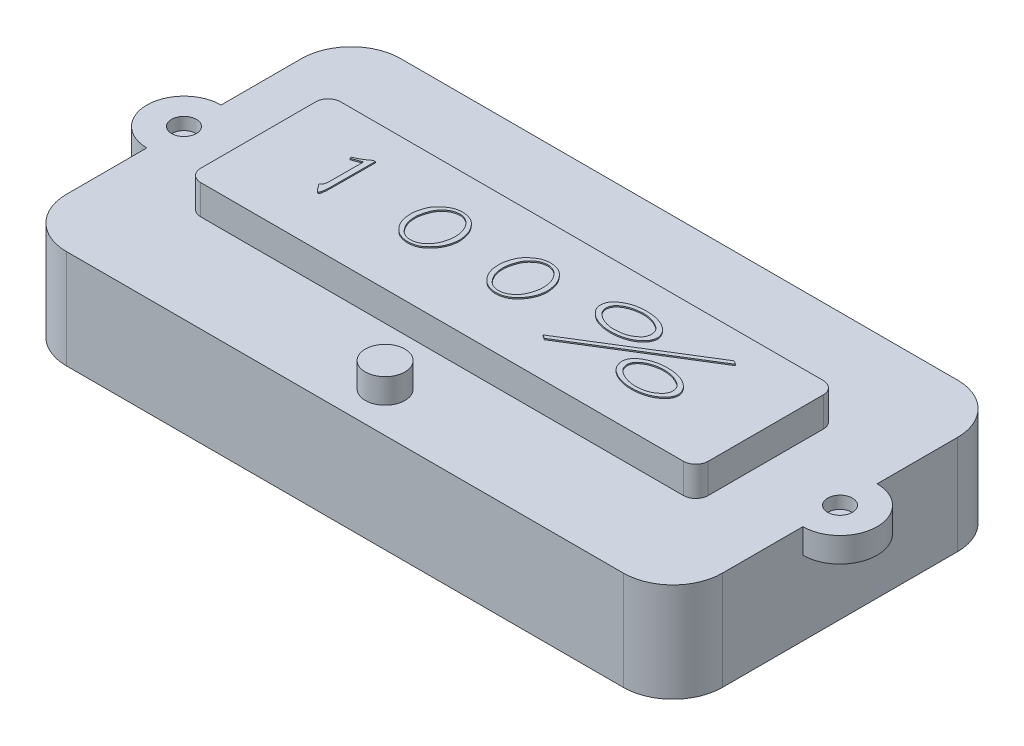
from build123d import *

# Parameters (mm, degrees)
SKETCH_1_W          = 53
SKETCH_1_H          = 27
EXTRUDE_1_DEPTH     = 8
SKETCH_2_W          = 41
SKETCH_2_H          = 11.3
EXTRUDE_2_DEPTH     = 2.4
SKETCH_3_W          = 11.553851908
SKETCH_3_H          = 4.159386687
EXTRUDE_3_DEPTH     = 7
SKETCH_4_R          = 3
EXTRUDE_4_DEPTH     = 2
SKETCH_5_R          = 1
CUT_EXTRUDE_1_DEPTH = 1
FILLET_1_R          = 4
FILLET_2_R          = 1
EXTRUDE_5_DEPTH     = 0.1
SKETCH_7_R          = 1.6
EXTRUDE_6_DEPTH     = 2


with BuildPart() as part:
    # 草图1 → 凸台-拉伸1 (new body)
    with BuildSketch(Plane(origin=(0, 0, 0), x_dir=(1, 0, 0), z_dir=(0, 1, 0))):
        Rectangle(SKETCH_1_W, SKETCH_1_H)
    extrude(amount=EXTRUDE_1_DEPTH)

    # 草图2 → 凸台-拉伸2 (add)
    with BuildSketch(Plane(origin=(0, 8, 0), x_dir=(1, 0, 0), z_dir=(0, 1, 0))):
        Rectangle(SKETCH_2_W, SKETCH_2_H)
    extrude(amount=EXTRUDE_2_DEPTH)

    # 草图3 → 凸台-拉伸3 (add)
    with BuildSketch(Plane.XZ):
        with Locations((-13.113621915, -7.076734294)):
            Rectangle(SKETCH_3_W, SKETCH_3_H)
    extrude(amount=EXTRUDE_3_DEPTH)

    # 草图4 → 凸台-拉伸4 (add)
    with BuildSketch(Plane(origin=(0, 8, 0), x_dir=(1, 0, 0), z_dir=(0, 1, 0))):
        with Locations((-26.5, 0)):
            Circle(SKETCH_4_R)
        with Locations((26.5, 0)):
            Circle(SKETCH_4_R)
    extrude(amount=-EXTRUDE_4_DEPTH)

    # 草图5 → 切除-拉伸1 (cut)
    with BuildSketch(Plane(origin=(0, 8, 0), x_dir=(1, 0, 0), z_dir=(0, 1, 0))):
        with Locations(Location((-26.5, 0, 0), (0, 0, 270))):
            Circle(SKETCH_5_R)
        with Locations(Location((26.5, 0, 0), (0, 0, 90))):
            Circle(SKETCH_5_R)
    extrude(amount=-CUT_EXTRUDE_1_DEPTH, mode=Mode.SUBTRACT)

    # 圆角1
    fillet_1_edges = [part.edges().sort_by_distance(p)[0] for p in [
        (-26.5, 4, -13.5),
        (26.5, 4, -13.5),
        (26.5, 4, 13.5),
        (-26.5, 4, 13.5),
    ]]
    fillet(fillet_1_edges, radius=FILLET_1_R)

    # 圆角2
    fillet_2_edges = [part.edges().sort_by_distance(p)[0] for p in [
        (-20.5, 9.2, -5.65),
        (-20.5, 9.2, 5.65),
        (20.5, 9.2, 5.65),
        (20.5, 9.2, -5.65),
    ]]
    fillet(fillet_2_edges, radius=FILLET_2_R)

    # 草图6 → 凸台-拉伸5 (add)
    # profile 1 of 6: a face of its own
    with BuildSketch(Plane(origin=(0, 10.4, 0), x_dir=(1, 0, 0), z_dir=(0, 1, 0))):
        with BuildLine():
            Line((-13.983861278, 2.770001374), (-13.816397925, 2.770001374))
            Line((-13.816397925, 2.770001374), (-13.832159182, -0.761505226))
            add(Edge.make_bspline(
                [(-13.832159182, -0.761505226), (-13.833409176, -0.79335883), (-13.835806255, -0.854443597), (-13.840235023, -0.941752434), (-13.84247207, -1.020948356), (-13.846784973, -1.091844649), (-13.850556729, -1.154572739), (-13.854522343, -1.209081866), (-13.858387604, -1.255393064), (-13.865786679, -1.328238966), (-13.881020601, -1.428412142), (-13.907191035, -1.532184295), (-13.932751005, -1.605127948), (-13.958590057, -1.642822215), (-13.99327255, -1.664050023), (-14.017134052, -1.660635034), (-14.029174891, -1.658911785)],
                knots=[0, 0, 0, 0, 1.378213158, 2.64296087, 3.779464555, 4.803175589, 5.713512737, 6.496372411, 7.166011382, 7.722572222, 9.662123845, 11.538670865, 12.347985498, 12.986819798, 13.488735427, 14, 14, 14, 14], degree=3))
            add(Edge.make_bspline(
                [(-14.029174891, -1.658911785), (-14.0324608, -1.65793184), (-14.045401368, -1.654072621), (-14.071669783, -1.645684027), (-14.10832665, -1.625415691), (-14.12601763, -1.599824521), (-14.135563375, -1.586015972)],
                knots=[0, 0, 0, 0, 0.310237486, 1.221777706, 2.50091963, 4, 4, 4, 4], degree=3))
            Line((-14.135563375, -1.586015972), (-14.212399502, -1.49932906))
            Line((-14.212399502, -1.49932906), (-14.378877777, -1.259954972))
            add(Edge.make_bspline(
                [(-14.378877777, -1.259954972), (-14.399131333, -1.237728891), (-14.433916318, -1.199556142), (-14.471527129, -1.146745307), (-14.49826218, -1.116013747), (-14.504282684, -1.084258141), (-14.472994049, -1.062461684), (-14.445855204, -1.023866854), (-14.407052114, -0.975312845), (-14.371062865, -0.916650418), (-14.336714266, -0.85444677), (-14.308283685, -0.786533816), (-14.289930767, -0.709444997), (-14.280864057, -0.63596082), (-14.275662843, -0.565541919), (-14.274566131, -0.497827294), (-14.271834896, -0.41773056), (-14.272261487, -0.359924928), (-14.272489293, -0.329055743)],
                knots=[0, 0, 0, 0, 1.39483416, 2.395593367, 3.013347112, 3.274459378, 3.77250837, 4.551824592, 5.543356785, 6.626737255, 7.752875516, 8.840650186, 10.035660145, 11.420700587, 12.277120127, 13.314863905, 14.566091905, 16, 16, 16, 16], degree=3))
            Line((-14.272489293, -0.329055743), (-14.257713115, 2.277462099))
            Line((-14.257713115, 2.277462099), (-15.04873119, 1.97799822))
            Line((-15.04873119, 1.97799822), (-15.10980606, 2.091282253))
            add(Edge.make_bspline(
                [(-15.10980606, 2.091282253), (-15.076632771, 2.106366617), (-15.012833548, 2.135377026), (-14.920969658, 2.177536993), (-14.836973439, 2.218088539), (-14.760345715, 2.256607287), (-14.69063085, 2.291864973), (-14.6282129, 2.324069047), (-14.574070079, 2.354968938), (-14.479692149, 2.409734989), (-14.343672199, 2.49791876), (-14.226234077, 2.58079073), (-14.16610081, 2.62322467)],
                knots=[0, 0, 0, 0, 1.00692027, 1.936519803, 2.792737023, 3.58394785, 4.306192721, 4.951448682, 5.524259564, 6.028434507, 7.966391127, 10, 10, 10, 10], degree=3))
            Line((-14.16610081, 2.62322467), (-13.983861278, 2.770001374))
        make_face()
    # profile 2 of 6: a face of its own
    with BuildSketch(Plane(origin=(0, 10.4, 0), x_dir=(1, 0, 0), z_dir=(0, 1, 0))):
        with BuildLine():
            add(Edge.make_bspline(
                [(-8.728270201, 0.695425949), (-8.721486595, 0.759293131), (-8.707509185, 0.890889475), (-8.664289176, 1.091124846), (-8.605798225, 1.300221777), (-8.544960159, 1.478706654), (-8.486598882, 1.623025088), (-8.432547855, 1.728491254), (-8.37288338, 1.831358868), (-8.304512332, 1.929745693), (-8.229505557, 2.02449981), (-8.14752175, 2.115599516), (-8.05732016, 2.202415636), (-7.961087134, 2.284638517), (-7.862701048, 2.361271963), (-7.766292008, 2.43155883), (-7.672310613, 2.493481364), (-7.582317596, 2.549314156), (-7.493970321, 2.595337193), (-7.409252637, 2.635488134), (-7.326859727, 2.666948965), (-7.222146238, 2.697880869), (-7.095852673, 2.725547744), (-6.949527449, 2.749426238), (-6.80961366, 2.763312522), (-6.718737908, 2.763173621), (-6.674381425, 2.763105824)],
                knots=[0, 0, 0, 0, 1.435448238, 2.957696506, 4.573626218, 6.289761708, 7.172081721, 8.052198838, 8.937569337, 9.829735077, 10.728854622, 11.638734953, 12.568314739, 13.526487822, 14.468084621, 15.356737884, 16.193802691, 16.984693715, 17.723775288, 18.420261263, 19.080336336, 19.693661647, 20.860520547, 21.968765884, 23.008553979, 24, 24, 24, 24], degree=3))
            add(Edge.make_bspline(
                [(-6.674381425, 2.763105824), (-6.632586373, 2.759912631), (-6.545866999, 2.753287164), (-6.412865698, 2.727974553), (-6.272057365, 2.694626935), (-6.125363737, 2.651557928), (-5.978674362, 2.593485622), (-5.837215687, 2.517870476), (-5.706952917, 2.420513787), (-5.586118026, 2.308691591), (-5.475583105, 2.186969424), (-5.373321304, 2.062556396), (-5.284882577, 1.933702076), (-5.206073241, 1.802697561), (-5.137029408, 1.666416156), (-5.079277799, 1.522249542), (-5.03059833, 1.36986612), (-4.993530874, 1.210128197), (-4.962728677, 1.046502609), (-4.941318006, 0.881071588), (-4.927906339, 0.715024534), (-4.926547511, 0.604167348), (-4.925867, 0.548649245)],
                knots=[0, 0, 0, 0, 0.801184793, 1.66235572, 2.585513684, 3.569079424, 4.583736151, 5.598256803, 6.627062832, 7.684960989, 8.742859147, 9.769842359, 10.762887269, 11.729054135, 12.692461248, 13.681466177, 14.696453294, 15.749080898, 16.815853354, 17.87999724, 18.938286835, 20, 20, 20, 20], degree=3))
            add(Edge.make_bspline(
                [(-4.925867, 0.548649245), (-4.931798981, 0.504933237), (-4.943879826, 0.415902898), (-4.968136688, 0.280908706), (-5.001708688, 0.14294682), (-5.039115904, 0.000992422), (-5.086983752, -0.143996374), (-5.151032639, -0.290255569), (-5.228853075, -0.438622435), (-5.320352233, -0.587668103), (-5.42346997, -0.73472999), (-5.540535747, -0.874961942), (-5.668649128, -1.007903947), (-5.80611966, -1.131878312), (-5.950163741, -1.243759032), (-6.10145552, -1.334538758), (-6.256332534, -1.405760428), (-6.413794109, -1.454738848), (-6.568617664, -1.488880023), (-6.717504429, -1.510151792), (-6.858725752, -1.522516514), (-6.950185036, -1.52016893), (-6.994531954, -1.519030631)],
                knots=[0, 0, 0, 0, 0.820987389, 1.671991345, 2.550948352, 3.462604775, 4.40368741, 5.389023878, 6.430408461, 7.519314144, 8.64170644, 9.769939038, 10.915204199, 12.074807502, 13.212679979, 14.303641303, 15.351014859, 16.377210433, 17.366121736, 18.298594175, 19.175019723, 20, 20, 20, 20], degree=3))
            add(Edge.make_bspline(
                [(-6.994531954, -1.519030631), (-7.036306656, -1.516457837), (-7.122934489, -1.511122657), (-7.256371523, -1.488534301), (-7.397444349, -1.453498757), (-7.544990943, -1.407227181), (-7.69486769, -1.345345532), (-7.840097202, -1.26132569), (-7.980940703, -1.158868977), (-8.115411998, -1.038606698), (-8.2400146, -0.904046455), (-8.351738495, -0.759438163), (-8.450307035, -0.607344752), (-8.531557936, -0.447525246), (-8.599382261, -0.286888908), (-8.650403736, -0.128473106), (-8.688561551, 0.02469978), (-8.706858098, 0.173589731), (-8.715565486, 0.315449955), (-8.722324451, 0.449450875), (-8.728126712, 0.575196827), (-8.728223559, 0.656345), (-8.728270201, 0.695425949)],
                knots=[0, 0, 0, 0, 0.798694611, 1.656246012, 2.579251766, 3.572630793, 4.606627905, 5.668105537, 6.767920926, 7.926902221, 9.106973368, 10.264461436, 11.412264669, 12.561915666, 13.683197639, 14.737970099, 15.737050481, 16.692017176, 17.597003567, 18.450788119, 19.253899779, 20, 20, 20, 20], degree=3))
        make_face()
        with BuildLine():
            add(Edge.make_bspline(
                [(-8.332268624, 0.681634849), (-8.334681653, 0.649799971), (-8.339801058, 0.582260119), (-8.338430708, 0.474391585), (-8.334729916, 0.354493176), (-8.32649653, 0.224183557), (-8.309649547, 0.086881506), (-8.278634386, -0.052707401), (-8.235911042, -0.193226284), (-8.181948622, -0.333628488), (-8.11652995, -0.4718768), (-8.038954161, -0.605073813), (-7.952449724, -0.73367503), (-7.855929268, -0.854217853), (-7.753110024, -0.964806082), (-7.64259724, -1.05770921), (-7.527303922, -1.132971742), (-7.408036801, -1.188678162), (-7.289388936, -1.228022165), (-7.175769862, -1.256756033), (-7.068073768, -1.275959075), (-6.997888057, -1.278452458), (-6.963994519, -1.279656543)],
                knots=[0, 0, 0, 0, 0.717068239, 1.521308859, 2.42195178, 3.412878773, 4.45435119, 5.526753806, 6.6214639, 7.75191832, 8.903745362, 10.054129944, 11.212414074, 12.383156875, 13.52095557, 14.599811259, 15.6190128, 16.605893547, 17.548534259, 18.423608324, 19.238741178, 20, 20, 20, 20], degree=3))
            add(Edge.make_bspline(
                [(-6.963994519, -1.279656543), (-6.93212366, -1.279515774), (-6.865245266, -1.27922038), (-6.760641964, -1.268053915), (-6.647995517, -1.24530069), (-6.527052183, -1.214878985), (-6.401330867, -1.16931237), (-6.275404318, -1.103642303), (-6.148883005, -1.021846128), (-6.026074954, -0.922114475), (-5.910478695, -0.8118211), (-5.804711087, -0.696658818), (-5.714834199, -0.57585624), (-5.638615503, -0.450719002), (-5.573960731, -0.321919928), (-5.516849816, -0.190995772), (-5.466961617, -0.057300294), (-5.426663091, 0.078623341), (-5.392179878, 0.213304153), (-5.36545021, 0.344469526), (-5.346403685, 0.47104154), (-5.33538846, 0.595725983), (-5.331616643, 0.722990036), (-5.33431517, 0.857861996), (-5.346825699, 1.002434725), (-5.359591605, 1.101979618), (-5.366197111, 1.153487474)],
                knots=[0, 0, 0, 0, 0.696054424, 1.460613383, 2.293573323, 3.205386292, 4.183645408, 5.207183604, 6.301657363, 7.47027476, 8.657745036, 9.790397704, 10.882329019, 11.941722301, 12.987694013, 14.028659101, 15.061483379, 16.103239286, 17.124638055, 18.098282529, 19.026653911, 19.919759867, 20.831347014, 21.807288352, 22.865417672, 24, 24, 24, 24], degree=3))
            add(Edge.make_bspline(
                [(-5.366197111, 1.153487474), (-5.376942135, 1.201852034), (-5.397899795, 1.296184822), (-5.435456966, 1.432221669), (-5.481655166, 1.557730848), (-5.531728303, 1.675783603), (-5.591464591, 1.788162187), (-5.65971719, 1.898429204), (-5.741102213, 2.005756901), (-5.828621599, 2.112394654), (-5.925628713, 2.21105364), (-6.030826637, 2.297100345), (-6.14356678, 2.367266057), (-6.261374237, 2.421527778), (-6.378036939, 2.462677026), (-6.488483127, 2.494527717), (-6.591456465, 2.516855906), (-6.658196362, 2.521505919), (-6.690142682, 2.523731736)],
                knots=[0, 0, 0, 0, 1.156621303, 2.255935196, 3.29138558, 4.276820831, 5.247233324, 6.259699209, 7.300724711, 8.389214013, 9.478755556, 10.525129936, 11.554661135, 12.569793392, 13.546964638, 14.439890244, 15.253223804, 16, 16, 16, 16], degree=3))
            add(Edge.make_bspline(
                [(-6.690142682, 2.523731736), (-6.724330835, 2.522632761), (-6.795580719, 2.520342439), (-6.905840541, 2.505749364), (-7.023871723, 2.482586132), (-7.150332603, 2.451209531), (-7.284414791, 2.401701772), (-7.423241033, 2.326497519), (-7.565581664, 2.223586761), (-7.713626644, 2.101781679), (-7.854521683, 1.955976319), (-7.977609865, 1.787626881), (-8.080571399, 1.600085148), (-8.159714424, 1.398519885), (-8.222397691, 1.197775493), (-8.272679464, 1.010039993), (-8.31074802, 0.840270539), (-8.325392814, 0.732318786), (-8.332268624, 0.681634849)],
                knots=[0, 0, 0, 0, 0.605189564, 1.261246411, 1.96572477, 2.734041866, 3.565359736, 4.488509888, 5.518948301, 6.670232429, 7.878823865, 9.097173559, 10.351053486, 11.654901815, 12.923287856, 14.072354317, 15.094959836, 16, 16, 16, 16], degree=3))
        make_face(mode=Mode.SUBTRACT)
    # profile 3 of 6: a face of its own
    with BuildSketch(Plane(origin=(0, 10.4, 0), x_dir=(1, 0, 0), z_dir=(0, 1, 0))):
        with BuildLine():
            add(Edge.make_bspline(
                [(-1.616791136, 0.695425949), (-1.61000753, 0.759293131), (-1.596030121, 0.890889475), (-1.552810112, 1.091124846), (-1.49431916, 1.300221777), (-1.433481095, 1.478706654), (-1.375119817, 1.623025088), (-1.321068791, 1.728491254), (-1.261404315, 1.831358868), (-1.193033267, 1.929745693), (-1.118026493, 2.02449981), (-1.036042685, 2.115599516), (-0.945841096, 2.202415636), (-0.84960807, 2.284638517), (-0.751221984, 2.361271963), (-0.654812944, 2.43155883), (-0.560831548, 2.493481364), (-0.470838532, 2.549314156), (-0.382491256, 2.595337193), (-0.297773572, 2.635488134), (-0.215380663, 2.666948965), (-0.110667173, 2.697880869), (0.015626392, 2.725547744), (0.161951616, 2.749426238), (0.301865405, 2.763312522), (0.392741156, 2.763173621), (0.437097639, 2.763105824)],
                knots=[0, 0, 0, 0, 1.435448238, 2.957696506, 4.573626218, 6.289761708, 7.172081721, 8.052198838, 8.937569337, 9.829735077, 10.728854622, 11.638734953, 12.568314739, 13.526487822, 14.468084621, 15.356737884, 16.193802691, 16.984693715, 17.723775288, 18.420261263, 19.080336336, 19.693661647, 20.860520547, 21.968765884, 23.008553979, 24, 24, 24, 24], degree=3))
            add(Edge.make_bspline(
                [(0.437097639, 2.763105824), (0.478892692, 2.759912631), (0.565612066, 2.753287164), (0.698613367, 2.727974553), (0.8394217, 2.694626935), (0.986115327, 2.651557928), (1.132804702, 2.593485622), (1.274263378, 2.517870476), (1.404526148, 2.420513787), (1.525361039, 2.308691591), (1.635895959, 2.186969424), (1.738157761, 2.062556396), (1.826596487, 1.933702076), (1.905405823, 1.802697561), (1.974449656, 1.666416156), (2.032201265, 1.522249542), (2.080880734, 1.36986612), (2.11794819, 1.210128197), (2.148750388, 1.046502609), (2.170161058, 0.881071588), (2.183572726, 0.715024534), (2.184931554, 0.604167348), (2.185612065, 0.548649245)],
                knots=[0, 0, 0, 0, 0.801184793, 1.66235572, 2.585513684, 3.569079424, 4.583736151, 5.598256803, 6.627062832, 7.684960989, 8.742859147, 9.769842359, 10.762887269, 11.729054135, 12.692461248, 13.681466177, 14.696453294, 15.749080898, 16.815853354, 17.87999724, 18.938286835, 20, 20, 20, 20], degree=3))
            add(Edge.make_bspline(
                [(2.185612065, 0.548649245), (2.179680083, 0.504933237), (2.167599238, 0.415902898), (2.143342377, 0.280908706), (2.109770377, 0.14294682), (2.07236316, 0.000992422), (2.024495312, -0.143996374), (1.960446425, -0.290255569), (1.882625989, -0.438622435), (1.791126831, -0.587668103), (1.688009095, -0.73472999), (1.570943318, -0.874961942), (1.442829937, -1.007903947), (1.305359404, -1.131878312), (1.161315323, -1.243759032), (1.010023545, -1.334538758), (0.855146531, -1.405760428), (0.697684956, -1.454738848), (0.542861401, -1.488880023), (0.393974636, -1.510151792), (0.252753312, -1.522516514), (0.161294029, -1.52016893), (0.116947111, -1.519030631)],
                knots=[0, 0, 0, 0, 0.820987389, 1.671991345, 2.550948352, 3.462604775, 4.40368741, 5.389023878, 6.430408461, 7.519314144, 8.64170644, 9.769939038, 10.915204199, 12.074807502, 13.212679979, 14.303641303, 15.351014859, 16.377210433, 17.366121736, 18.298594175, 19.175019723, 20, 20, 20, 20], degree=3))
            add(Edge.make_bspline(
                [(0.116947111, -1.519030631), (0.075172409, -1.516457837), (-0.011455425, -1.511122657), (-0.144892458, -1.488534301), (-0.285965285, -1.453498757), (-0.433511879, -1.407227181), (-0.583388625, -1.345345532), (-0.728618137, -1.26132569), (-0.869461638, -1.158868977), (-1.003932933, -1.038606698), (-1.128535535, -0.904046455), (-1.24025943, -0.759438163), (-1.33882797, -0.607344752), (-1.420078872, -0.447525246), (-1.487903197, -0.286888908), (-1.538924672, -0.128473106), (-1.577082486, 0.02469978), (-1.595379033, 0.173589731), (-1.604086421, 0.315449955), (-1.610845386, 0.449450875), (-1.616647647, 0.575196827), (-1.616744495, 0.656345), (-1.616791136, 0.695425949)],
                knots=[0, 0, 0, 0, 0.798694611, 1.656246012, 2.579251766, 3.572630793, 4.606627905, 5.668105537, 6.767920926, 7.926902221, 9.106973368, 10.264461436, 11.412264669, 12.561915666, 13.683197639, 14.737970099, 15.737050481, 16.692017176, 17.597003567, 18.450788119, 19.253899779, 20, 20, 20, 20], degree=3))
        make_face()
        with BuildLine():
            add(Edge.make_bspline(
                [(-1.220789559, 0.681634849), (-1.223202589, 0.649799971), (-1.228321993, 0.582260119), (-1.226951644, 0.474391585), (-1.223250852, 0.354493176), (-1.215017466, 0.224183557), (-1.198170482, 0.086881506), (-1.167155322, -0.052707401), (-1.124431977, -0.193226284), (-1.070469558, -0.333628488), (-1.005050885, -0.4718768), (-0.927475097, -0.605073813), (-0.840970659, -0.73367503), (-0.744450204, -0.854217853), (-0.64163096, -0.964806082), (-0.531118176, -1.05770921), (-0.415824858, -1.132971742), (-0.296557736, -1.188678162), (-0.177909871, -1.228022165), (-0.064290797, -1.256756033), (0.043405296, -1.275959075), (0.113591007, -1.278452458), (0.147484546, -1.279656543)],
                knots=[0, 0, 0, 0, 0.717068239, 1.521308859, 2.42195178, 3.412878773, 4.45435119, 5.526753806, 6.6214639, 7.75191832, 8.903745362, 10.054129944, 11.212414074, 12.383156875, 13.52095557, 14.599811259, 15.6190128, 16.605893547, 17.548534259, 18.423608324, 19.238741178, 20, 20, 20, 20], degree=3))
            add(Edge.make_bspline(
                [(0.147484546, -1.279656543), (0.179355404, -1.279515774), (0.246233798, -1.27922038), (0.350837101, -1.268053915), (0.463483548, -1.24530069), (0.584426881, -1.214878985), (0.710148198, -1.16931237), (0.836074747, -1.103642303), (0.96259606, -1.021846128), (1.085404111, -0.922114475), (1.201000369, -0.8118211), (1.306767978, -0.696658818), (1.396644865, -0.57585624), (1.472863561, -0.450719002), (1.537518333, -0.321919928), (1.594629248, -0.190995772), (1.644517448, -0.057300294), (1.684815974, 0.078623341), (1.719299187, 0.213304153), (1.746028855, 0.344469526), (1.765075379, 0.47104154), (1.776090605, 0.595725983), (1.779862421, 0.722990036), (1.777163894, 0.857861996), (1.764653365, 1.002434725), (1.75188746, 1.101979618), (1.745281953, 1.153487474)],
                knots=[0, 0, 0, 0, 0.696054424, 1.460613383, 2.293573323, 3.205386292, 4.183645408, 5.207183604, 6.301657363, 7.47027476, 8.657745036, 9.790397704, 10.882329019, 11.941722301, 12.987694013, 14.028659101, 15.061483379, 16.103239286, 17.124638055, 18.098282529, 19.026653911, 19.919759867, 20.831347014, 21.807288352, 22.865417672, 24, 24, 24, 24], degree=3))
            add(Edge.make_bspline(
                [(1.745281953, 1.153487474), (1.73453693, 1.201852034), (1.71357927, 1.296184822), (1.676022099, 1.432221669), (1.629823898, 1.557730848), (1.579750761, 1.675783603), (1.520014473, 1.788162187), (1.451761875, 1.898429204), (1.370376852, 2.005756901), (1.282857466, 2.112394654), (1.185850351, 2.21105364), (1.080652428, 2.297100345), (0.967912284, 2.367266057), (0.850104828, 2.421527778), (0.733442125, 2.462677026), (0.622995938, 2.494527717), (0.520022599, 2.516855906), (0.453282703, 2.521505919), (0.421336383, 2.523731736)],
                knots=[0, 0, 0, 0, 1.156621303, 2.255935196, 3.29138558, 4.276820831, 5.247233324, 6.259699209, 7.300724711, 8.389214013, 9.478755556, 10.525129936, 11.554661135, 12.569793392, 13.546964638, 14.439890244, 15.253223804, 16, 16, 16, 16], degree=3))
            add(Edge.make_bspline(
                [(0.421336383, 2.523731736), (0.387148229, 2.522632761), (0.315898346, 2.520342439), (0.205638524, 2.505749364), (0.087607341, 2.482586132), (-0.038853539, 2.451209531), (-0.172935726, 2.401701772), (-0.311761968, 2.326497519), (-0.4541026, 2.223586761), (-0.60214758, 2.101781679), (-0.743042619, 1.955976319), (-0.8661308, 1.787626881), (-0.969092335, 1.600085148), (-1.04823536, 1.398519885), (-1.110918626, 1.197775493), (-1.161200399, 1.010039993), (-1.199268956, 0.840270539), (-1.213913749, 0.732318786), (-1.220789559, 0.681634849)],
                knots=[0, 0, 0, 0, 0.605189564, 1.261246411, 1.96572477, 2.734041866, 3.565359736, 4.488509888, 5.518948301, 6.670232429, 7.878823865, 9.097173559, 10.351053486, 11.654901815, 12.923287856, 14.072354317, 15.094959836, 16, 16, 16, 16], degree=3))
        make_face(mode=Mode.SUBTRACT)
    # profile 4 of 6: a face of its own
    with BuildSketch(Plane(origin=(0, 10.4, 0), x_dir=(1, 0, 0), z_dir=(0, 1, 0))):
        Polygon((14.605679433, 3.314749812), (14.924844883, 3.142361066), (5.373523267, -2.76909531), (5.09967143, -2.576019914), align=None)
    # profile 5 of 6: a face of its own
    with BuildSketch(Plane(origin=(0, 10.4, 0), x_dir=(1, 0, 0), z_dir=(0, 1, 0))):
        with BuildLine():
            add(Edge.make_bspline(
                [(10.210258945, -1.658911785), (10.192041162, -1.613325848), (10.156870626, -1.525319427), (10.124327673, -1.39115542), (10.109315108, -1.261940024), (10.115526974, -1.136983759), (10.139933527, -1.016572408), (10.179251523, -0.899831787), (10.235549847, -0.787065486), (10.307993441, -0.678209811), (10.397943809, -0.573498683), (10.503477069, -0.471799842), (10.627205511, -0.375169612), (10.764815876, -0.283496389), (10.911635061, -0.199354453), (11.061283584, -0.123909943), (11.212525549, -0.060821688), (11.363765651, -0.008874268), (11.513096202, 0.032714935), (11.658135084, 0.067970122), (11.798661119, 0.093386493), (11.975053664, 0.115982816), (12.180124452, 0.133083553), (12.340301598, 0.139683833), (12.415849817, 0.142796882)],
                knots=[0, 0, 0, 0, 0.960561217, 1.854421793, 2.695392607, 3.500295363, 4.293706313, 5.095080753, 5.906229509, 6.75535114, 7.649720656, 8.604969972, 9.621522645, 10.720384955, 11.841257072, 12.93428753, 14.00098065, 15.04849834, 16.064501486, 17.036408392, 17.971237073, 18.859968946, 20.518991242, 22, 22, 22, 22], degree=3))
            add(Edge.make_bspline(
                [(12.415849817, 0.142796882), (12.499284302, 0.14172416), (12.660444066, 0.139652118), (12.893732222, 0.122074074), (13.10995466, 0.091896947), (13.309624893, 0.049493083), (13.493355331, -0.002952701), (13.662754775, -0.062847316), (13.818062426, -0.131167951), (13.957685358, -0.210014485), (14.084581689, -0.291535202), (14.198899407, -0.374645521), (14.302362392, -0.456858775), (14.393757918, -0.543343077), (14.477746967, -0.636469688), (14.549575928, -0.745390613), (14.616943966, -0.867026062), (14.666294712, -0.978059294), (14.699957841, -1.073143407), (14.715323231, -1.148712442), (14.723260405, -1.225920901), (14.723364227, -1.3055104), (14.71420046, -1.387698606), (14.696219334, -1.471985897), (14.67037246, -1.558586417), (14.647819388, -1.615725335), (14.636216868, -1.645120685)],
                knots=[0, 0, 0, 0, 1.791843842, 3.461076448, 5.020978785, 6.477511013, 7.841497716, 9.121916642, 10.334235054, 11.480245017, 12.562068167, 13.57213314, 14.514959867, 15.397992567, 16.272421704, 17.201564875, 18.19276612, 19.256858013, 19.807723825, 20.355465737, 20.908449318, 21.472652192, 22.061443915, 22.681104621, 23.321488864, 24, 24, 24, 24], degree=3))
            add(Edge.make_bspline(
                [(14.636216868, -1.645120685), (14.619932505, -1.67527343), (14.586979244, -1.736290944), (14.528000042, -1.82435162), (14.460763019, -1.911142761), (14.384519272, -1.997452312), (14.297232273, -2.082710676), (14.196900874, -2.166672963), (14.08323678, -2.249774407), (13.957162647, -2.334741626), (13.813698064, -2.414831786), (13.651354143, -2.487364348), (13.470045061, -2.552895957), (13.272656616, -2.612465637), (13.063120876, -2.661234376), (12.846280691, -2.696603854), (12.624836926, -2.719138631), (12.475336842, -2.721571883), (12.40008856, -2.722796618)],
                knots=[0, 0, 0, 0, 0.632004645, 1.278933359, 1.95270953, 2.656592765, 3.402060492, 4.201829856, 5.06821813, 5.99912172, 7.005381873, 8.095442555, 9.27612187, 10.560326166, 11.897666162, 13.242287157, 14.611952924, 16, 16, 16, 16], degree=3))
            add(Edge.make_bspline(
                [(12.40008856, -2.722796618), (12.338997303, -2.722806184), (12.216035811, -2.722825438), (12.030518297, -2.71061736), (11.84307683, -2.68790294), (11.654948008, -2.654508435), (11.469028393, -2.611206935), (11.288263183, -2.554592643), (11.114576709, -2.485781353), (10.949398537, -2.406669097), (10.797109795, -2.320330175), (10.662049848, -2.228660881), (10.544480512, -2.135390877), (10.44674212, -2.03866731), (10.366330652, -1.941137412), (10.300545918, -1.84568491), (10.246327897, -1.753204232), (10.221954005, -1.689485334), (10.210258945, -1.658911785)],
                knots=[0, 0, 0, 0, 1.139009149, 2.292541888, 3.464471948, 4.658446909, 5.854069436, 7.021897007, 8.187410583, 9.334979515, 10.434747695, 11.448675538, 12.37629755, 13.22929157, 14.007824555, 14.729705065, 15.390488138, 16, 16, 16, 16], degree=3))
        make_face()
        with BuildLine():
            add(Edge.make_bspline(
                [(12.40008856, -2.437123839), (12.461525063, -2.435457062), (12.58128029, -2.432208093), (12.755133307, -2.416989234), (12.918363717, -2.39598782), (13.070276507, -2.366310457), (13.211503309, -2.330097321), (13.342141652, -2.287037201), (13.462072649, -2.236112449), (13.569978771, -2.176334212), (13.667966935, -2.113997669), (13.757879853, -2.05274397), (13.840048443, -1.993131012), (13.912801728, -1.932968948), (13.977240144, -1.874052863), (14.032525076, -1.815523911), (14.080710597, -1.758705244), (14.130641657, -1.683164453), (14.180174629, -1.589814779), (14.223410158, -1.477075208), (14.250430767, -1.364987391), (14.254147443, -1.289975413), (14.255976548, -1.253059422)],
                knots=[0, 0, 0, 0, 1.525384467, 2.973358791, 4.330247025, 5.609164118, 6.813204684, 7.947396024, 9.02094238, 10.042313272, 11.005734716, 11.903317521, 12.742954084, 13.52468402, 14.245751358, 14.908828745, 15.522518073, 16.092243936, 17.153370658, 18.138918313, 19.084097291, 20, 20, 20, 20], degree=3))
            add(Edge.make_bspline(
                [(14.255976548, -1.253059422), (14.252465966, -1.214870701), (14.245634407, -1.140555792), (14.223009107, -1.033333034), (14.189067831, -0.934048185), (14.146133988, -0.84207603), (14.092043366, -0.757989783), (14.027646392, -0.682048811), (13.953225765, -0.61299755), (13.839811354, -0.535465005), (13.693196357, -0.449727332), (13.515449717, -0.360552873), (13.33895096, -0.286867981), (13.162051603, -0.230589711), (12.983759418, -0.188084412), (12.802781306, -0.156932853), (12.617957168, -0.135277114), (12.493402017, -0.131159887), (12.430625995, -0.129084797)],
                knots=[0, 0, 0, 0, 0.782748487, 1.523221556, 2.231506865, 2.921427941, 3.59107369, 4.266802695, 4.950207676, 5.657253862, 7.067238038, 8.416764774, 9.715641792, 10.968990516, 12.203486739, 13.455884318, 14.717761085, 16, 16, 16, 16], degree=3))
            add(Edge.make_bspline(
                [(12.430625995, -0.129084797), (12.357669651, -0.130599923), (12.212685396, -0.133610894), (11.996891355, -0.157816955), (11.78532383, -0.198413619), (11.580227874, -0.253038744), (11.386118818, -0.319807616), (11.20886681, -0.399483323), (11.049205525, -0.488824166), (10.911278984, -0.590111584), (10.79312532, -0.696756452), (10.698703625, -0.808467851), (10.626345405, -0.923008316), (10.579977004, -1.040962333), (10.555633804, -1.157713048), (10.54824783, -1.27116962), (10.558015189, -1.381436461), (10.579725106, -1.451010087), (10.590499265, -1.48553796)],
                knots=[0, 0, 0, 0, 1.330804406, 2.644673178, 3.955889683, 5.257904747, 6.514030128, 7.696512022, 8.799212499, 9.845276277, 10.812031706, 11.69643006, 12.506087253, 13.272572485, 13.995169269, 14.673418931, 15.341646748, 16, 16, 16, 16], degree=3))
            add(Edge.make_bspline(
                [(10.590499265, -1.48553796), (10.601710212, -1.521035252), (10.623637987, -1.590465302), (10.672183886, -1.68736636), (10.731039916, -1.775483615), (10.802713592, -1.854293978), (10.884965804, -1.926128809), (10.975630145, -1.995948696), (11.075625666, -2.063990542), (11.18513398, -2.130666101), (11.307745692, -2.192840933), (11.443381593, -2.251969159), (11.593739594, -2.305513697), (11.754205167, -2.355078903), (11.919687334, -2.396649905), (12.084100845, -2.423562195), (12.243779707, -2.44033621), (12.348500097, -2.438184056), (12.40008856, -2.437123839)],
                knots=[0, 0, 0, 0, 0.822999401, 1.609725317, 2.389976568, 3.162092357, 3.960154966, 4.804921459, 5.694090249, 6.636572634, 7.641149864, 8.735020485, 9.910055423, 11.172416087, 12.452402187, 13.683311202, 14.858728328, 16, 16, 16, 16], degree=3))
        make_face(mode=Mode.SUBTRACT)
    # profile 6 of 6: a face of its own
    with BuildSketch(Plane(origin=(0, 10.4, 0), x_dir=(1, 0, 0), z_dir=(0, 1, 0))):
        with BuildLine():
            add(Edge.make_bspline(
                [(5.388299445, 1.452951353), (5.372216254, 1.494919854), (5.340526523, 1.57761305), (5.315966327, 1.707721273), (5.306087977, 1.838121537), (5.316658359, 1.968702102), (5.343264087, 2.095874779), (5.384044468, 2.218129473), (5.437929655, 2.334151923), (5.508747002, 2.443315424), (5.595598809, 2.548214536), (5.702118463, 2.647993953), (5.82605983, 2.746287493), (5.966886436, 2.837963729), (6.114882819, 2.923784764), (6.264693682, 2.999131812), (6.411922804, 3.063244747), (6.557776774, 3.11599269), (6.701708638, 3.157344629), (6.842945007, 3.19397233), (6.982879562, 3.220315515), (7.163209629, 3.244011532), (7.376778834, 3.262876092), (7.544598621, 3.266654021), (7.624427752, 3.26845112)],
                knots=[0, 0, 0, 0, 0.87478715, 1.723648551, 2.570793687, 3.418398446, 4.268538744, 5.098696483, 5.92648036, 6.755921711, 7.629020081, 8.575545534, 9.596522127, 10.709982686, 11.848853364, 12.93124663, 13.977978918, 14.97851282, 15.953037667, 16.897221305, 17.822722889, 18.727346484, 20.443252187, 22, 22, 22, 22], degree=3))
            add(Edge.make_bspline(
                [(7.624427752, 3.26845112), (7.705579727, 3.266414231), (7.863543293, 3.262449394), (8.093440388, 3.241415471), (8.309402954, 3.209678885), (8.510512222, 3.164945496), (8.696292555, 3.11205513), (8.866708037, 3.052251495), (9.020762953, 2.984797926), (9.158394253, 2.908824021), (9.282582385, 2.82981026), (9.395412262, 2.749296016), (9.495886226, 2.666071248), (9.588001026, 2.581464794), (9.671147952, 2.488222274), (9.743719365, 2.380178153), (9.810680808, 2.258581739), (9.860108089, 2.147601586), (9.893752398, 2.052508788), (9.909212029, 1.976624405), (9.917063438, 1.898740377), (9.91710082, 1.81786022), (9.90823579, 1.734638065), (9.889719124, 1.649154855), (9.86423832, 1.561165648), (9.841636892, 1.502704756), (9.830018625, 1.472652924)],
                knots=[0, 0, 0, 0, 1.748525465, 3.403531658, 4.970305835, 6.448169072, 7.83872544, 9.129771147, 10.336503638, 11.457225399, 12.513083372, 13.506520426, 14.441299579, 15.322220226, 16.199354765, 17.125528174, 18.119796103, 19.187180197, 19.739750335, 20.289186909, 20.850919271, 21.423942092, 22.028623663, 22.650201541, 23.306135873, 24, 24, 24, 24], degree=3))
            add(Edge.make_bspline(
                [(9.830018625, 1.472652924), (9.81613804, 1.441508714), (9.78799052, 1.378353429), (9.734208508, 1.286963836), (9.668240575, 1.198670325), (9.593464165, 1.110227393), (9.505762533, 1.024296658), (9.405514549, 0.939291619), (9.292115506, 0.855103851), (9.16568142, 0.770323186), (9.021845051, 0.689654668), (8.857628023, 0.617499805), (8.673660003, 0.552109001), (8.473327144, 0.492511835), (8.260846614, 0.443709362), (8.042015639, 0.408602376), (7.819301914, 0.385759404), (7.669469119, 0.383374145), (7.593890317, 0.38217097)],
                knots=[0, 0, 0, 0, 0.624789067, 1.266968482, 1.938821928, 2.643349472, 3.388279344, 4.186833853, 5.051284314, 5.976246642, 6.976084588, 8.070173669, 9.260292446, 10.553606616, 11.900007713, 13.253870533, 14.614794746, 16, 16, 16, 16], degree=3))
            add(Edge.make_bspline(
                [(7.593890317, 0.38217097), (7.532459299, 0.381977361), (7.408446104, 0.381586515), (7.221386013, 0.396719699), (7.031314093, 0.420140762), (6.840780777, 0.454045104), (6.653662945, 0.498568335), (6.475386621, 0.554870167), (6.306599112, 0.620492805), (6.149581303, 0.698513467), (6.003897474, 0.784650736), (5.871585044, 0.87877735), (5.751356415, 0.977896593), (5.647564205, 1.083451702), (5.559814215, 1.187596401), (5.486164975, 1.283092708), (5.428342641, 1.369370565), (5.400875603, 1.426701571), (5.388299445, 1.452951353)],
                knots=[0, 0, 0, 0, 1.142283656, 2.305972584, 3.487858179, 4.703987669, 5.903996091, 7.063091217, 8.179206937, 9.269142614, 10.320874934, 11.324188166, 12.286909948, 13.215524914, 14.073492858, 14.81870846, 15.459129561, 16, 16, 16, 16], degree=3))
        make_face()
        with BuildLine():
            add(Edge.make_bspline(
                [(7.593890317, 0.674739299), (7.655655671, 0.67713126), (7.775415939, 0.681769164), (7.949616013, 0.697807209), (8.113078004, 0.720038947), (8.266001399, 0.749569162), (8.408513848, 0.785285917), (8.539661515, 0.830493277), (8.661578435, 0.879236405), (8.770707855, 0.938913449), (8.870705301, 0.999483833), (8.960988082, 1.060613162), (9.042709181, 1.120110972), (9.115374416, 1.17824369), (9.178202946, 1.237258834), (9.231977211, 1.294712127), (9.277656361, 1.35098013), (9.32238419, 1.425734098), (9.366089397, 1.51813692), (9.405542156, 1.629155411), (9.429093999, 1.740590189), (9.432385967, 1.815026826), (9.434017048, 1.851908166)],
                knots=[0, 0, 0, 0, 1.541187741, 2.988294308, 4.360558814, 5.653319689, 6.870754949, 8.020464112, 9.110786636, 10.140121411, 11.117533192, 12.025969242, 12.85797171, 13.638067366, 14.344838417, 15.005315337, 15.599978011, 16.147685408, 17.17320244, 18.144317043, 19.080559317, 20, 20, 20, 20], degree=3))
            add(Edge.make_bspline(
                [(9.434017048, 1.851908166), (9.430520237, 1.890102115), (9.423715474, 1.964427198), (9.400835305, 2.071882861), (9.367422577, 2.171706721), (9.323602964, 2.264182734), (9.270466709, 2.349790914), (9.205700955, 2.426845743), (9.131056322, 2.496838217), (9.018597424, 2.576663787), (8.874054452, 2.664250049), (8.701205171, 2.755943974), (8.531622981, 2.830056791), (8.363459094, 2.888678131), (8.191578344, 2.931336777), (8.011834739, 2.961869866), (7.821470289, 2.979501244), (7.691121272, 2.981669133), (7.624427752, 2.98277834)],
                knots=[0, 0, 0, 0, 0.784737218, 1.527091609, 2.243544778, 2.935218739, 3.617914879, 4.300511705, 4.990222538, 5.706928002, 7.119390998, 8.448569398, 9.710056575, 10.904916677, 12.090320588, 13.331508806, 14.634657374, 16, 16, 16, 16], degree=3))
            add(Edge.make_bspline(
                [(7.624427752, 2.98277834), (7.551471464, 2.980120362), (7.406492225, 2.97483841), (7.190743479, 2.950037073), (6.979259713, 2.909317876), (6.773778731, 2.855761359), (6.579711589, 2.790279439), (6.402056239, 2.712087271), (6.2425923, 2.624149655), (6.10386808, 2.524761675), (5.98581005, 2.418898582), (5.890623223, 2.3069185), (5.818923015, 2.189447723), (5.772732572, 2.067869717), (5.748673988, 1.948172539), (5.741112012, 1.834169138), (5.750352252, 1.725865633), (5.773098092, 1.659173046), (5.784301022, 1.626325178)],
                knots=[0, 0, 0, 0, 1.331027037, 2.645026118, 3.955705237, 5.25565661, 6.514974423, 7.686626684, 8.79115019, 9.829765641, 10.792090247, 11.676126141, 12.500791684, 13.289290281, 14.035040387, 14.71898899, 15.369068113, 16, 16, 16, 16], degree=3))
            add(Edge.make_bspline(
                [(5.784301022, 1.626325178), (5.795555895, 1.592471472), (5.817898537, 1.525266698), (5.867391528, 1.430637454), (5.928912083, 1.342225198), (6.003315901, 1.260797523), (6.08806097, 1.185270179), (6.179651028, 1.112450748), (6.278617484, 1.042402286), (6.385303024, 0.974452848), (6.504220023, 0.91195255), (6.636206755, 0.854032417), (6.782891208, 0.801312246), (6.940280918, 0.752413781), (7.104432864, 0.71336855), (7.269353744, 0.686840312), (7.432391498, 0.671795773), (7.540341316, 0.673763299), (7.593890317, 0.674739299)],
                knots=[0, 0, 0, 0, 0.789092244, 1.566468573, 2.35529267, 3.168838977, 4.002929374, 4.867257073, 5.759170205, 6.687320022, 7.666546402, 8.731341901, 9.877079304, 11.117015245, 12.380026065, 13.610305721, 14.81458121, 16, 16, 16, 16], degree=3))
        make_face(mode=Mode.SUBTRACT)
    extrude(amount=EXTRUDE_5_DEPTH)

    # 草图7 → 凸台-拉伸6 (add)
    with BuildSketch(Plane(origin=(0, 8, 0), x_dir=(1, 0, 0), z_dir=(0, 1, 0))):
        with Locations(Location((0, -10.25, 0), (0, 0, 270))):
            Circle(SKETCH_7_R)
    extrude(amount=EXTRUDE_6_DEPTH)


solid = part.part
